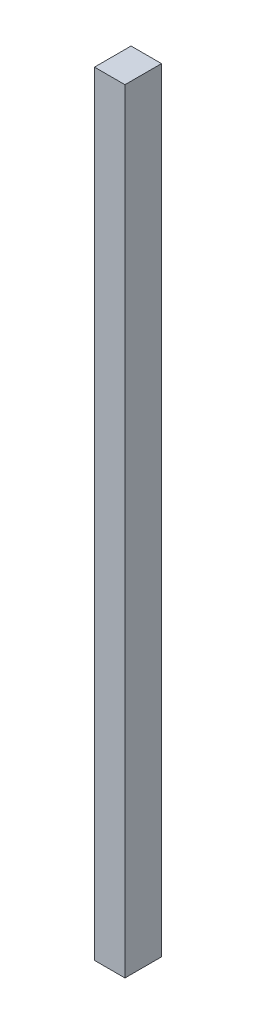
from build123d import *

# Parameters (mm, degrees)
SKETCH1_W           = 5
SKETCH1_H           = 6
BOSS_EXTRUDE1_DEPTH = 127


with BuildPart() as part:
    # Sketch1 → Boss-Extrude1 (new body)
    with BuildSketch(Plane(origin=(0, 0, 0), x_dir=(1, 0, 0), z_dir=(0, 1, 0))):
        Rectangle(SKETCH1_W, SKETCH1_H)
    extrude(amount=BOSS_EXTRUDE1_DEPTH)


solid = part.part
